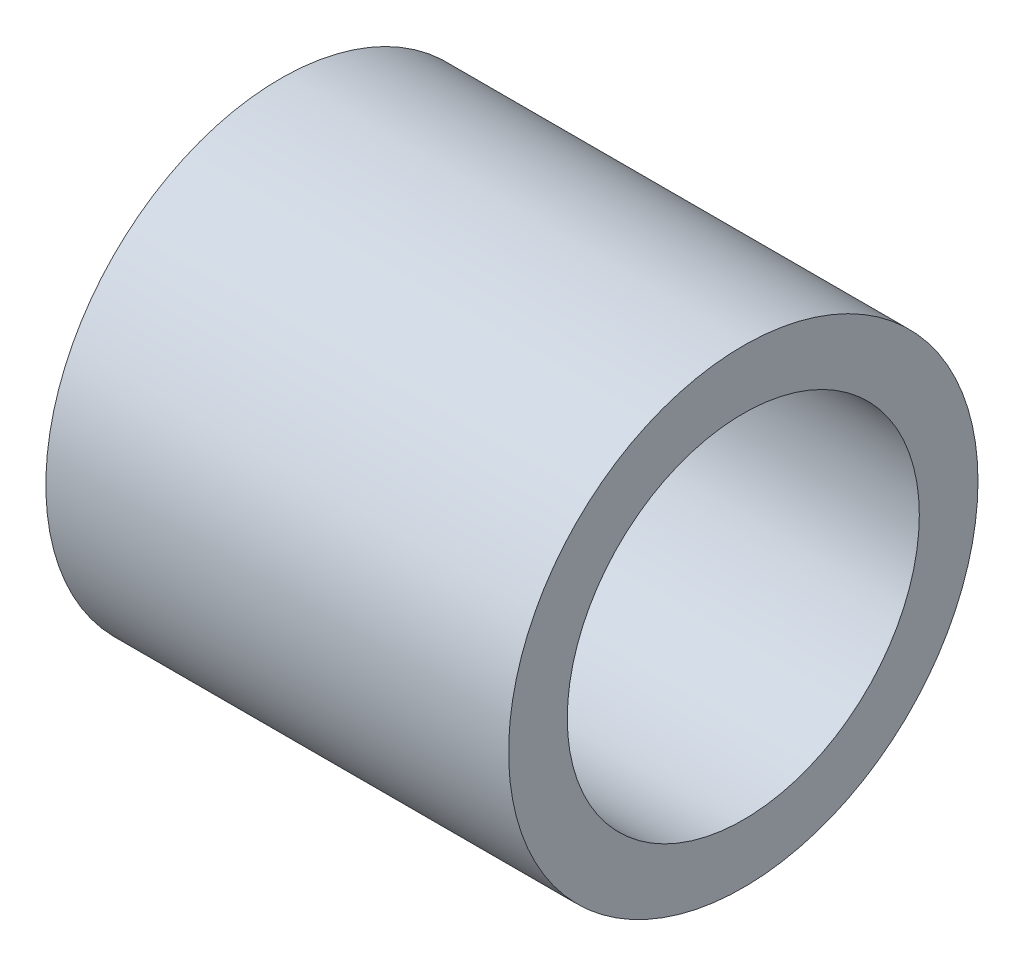
from build123d import *

# Parameters (mm, degrees)
SKETCH1_R           = 12.7
SKETCH1_R_2         = 9.525
BOSS_EXTRUDE1_DEPTH = 12.52


with BuildPart() as part:
    # Sketch1 → Boss-Extrude1 (new, symmetric)
    with BuildSketch(Plane(origin=(0, 0, 0), x_dir=(0, 0, -1), z_dir=(1, 0, 0))):
        Circle(SKETCH1_R)
        Circle(SKETCH1_R_2, mode=Mode.SUBTRACT)
    extrude(amount=BOSS_EXTRUDE1_DEPTH, both=True)


solid = part.part
